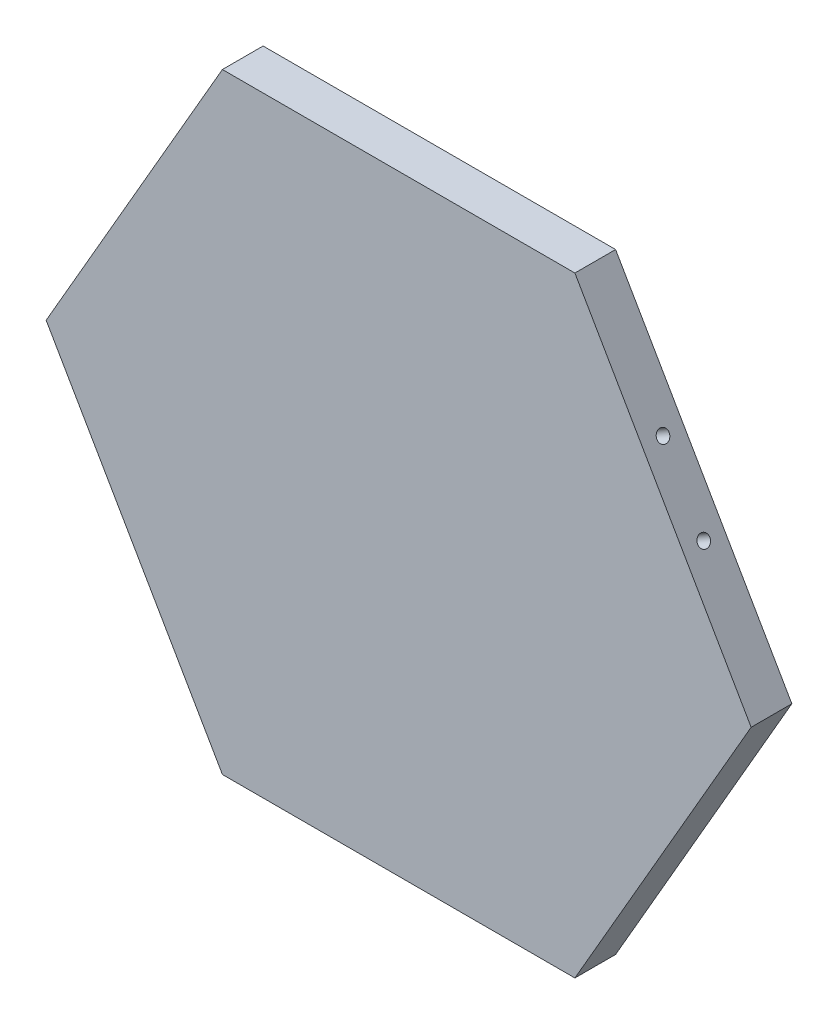
from build123d import *

# Parameters (mm, degrees)
BOSS_EXTRUDE1_DEPTH = 10
SKETCH2_R           = 1.5
CUT_EXTRUDE1_DEPTH  = 5
CIRPATTERN1_COUNT   = 3


with BuildPart() as part:
    # Sketch1 → Boss-Extrude1 (new body)
    with BuildSketch(Plane.XY):
        Polygon((86.602540378, 0), (43.301270189, 75), (-43.301270189, 75), (-86.602540378, 0), (-43.301270189, -75), (43.301270189, -75), align=None)
    extrude(amount=BOSS_EXTRUDE1_DEPTH)

    # Sketch2 → Cut-Extrude1 (cut)
    with BuildSketch(Plane.XZ.offset(75)):
        with Locations((-10, 5)):
            Circle(SKETCH2_R)
        with Locations((10, 5)):
            Circle(SKETCH2_R)
    cut_extrude1 = extrude(amount=-CUT_EXTRUDE1_DEPTH, mode=Mode.SUBTRACT)

    # CirPattern1: Cut-Extrude1 ×3 about axis
    cirpattern1_axis = Axis((0, 0, 0), (0, 0, 1))
    for i in range(1, CIRPATTERN1_COUNT):
        add(cut_extrude1.rotate(cirpattern1_axis, i * 360 / CIRPATTERN1_COUNT), mode=Mode.SUBTRACT)


solid = part.part
